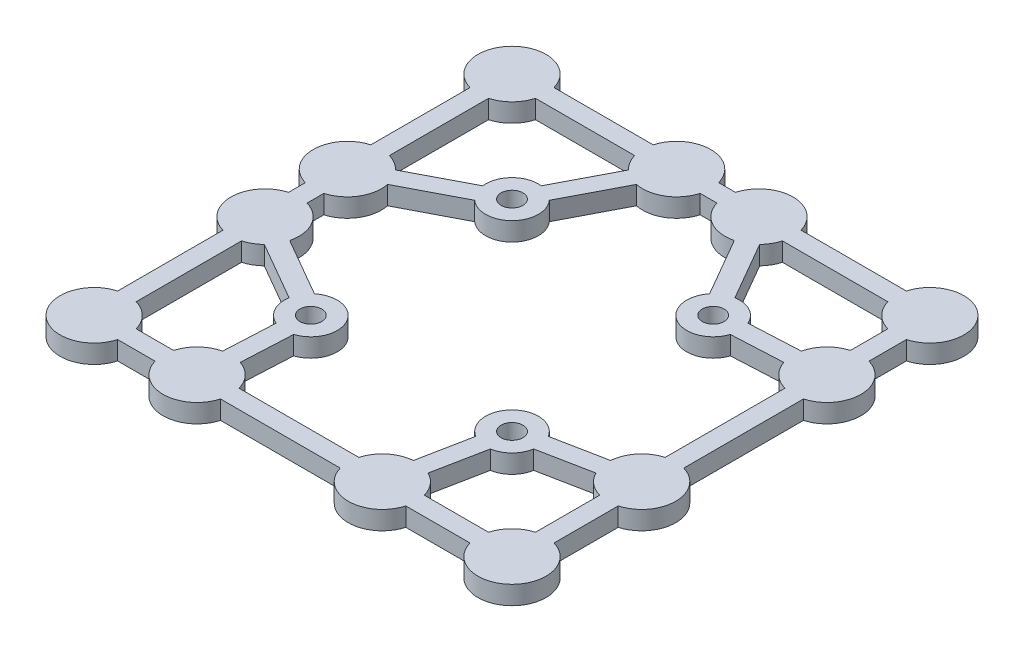
from build123d import *

# Parameters (mm, degrees)
SKETCH1_R           = 3.525
BOSS_EXTRUDE1_DEPTH = 6


with BuildPart() as part:
    # Sketch1 → Boss-Extrude1 (new body)
    with BuildSketch(Plane(origin=(0, 0, 0), x_dir=(1, 0, 0), z_dir=(0, 1, 0))):
        with BuildLine():
            Line((-56.916994756, 70.5), (-24.883005244, 70.5))
            ThreePointArc((-24.883005244, 70.5), (-14.3, 78.5), (-3.716994756, 70.5))
            Line((-3.716994756, 70.5), (1.716994756, 70.5))
            ThreePointArc((1.716994756, 70.5), (12.3, 78.5), (22.883005244, 70.5))
            Line((22.883005244, 70.5), (56.916994756, 70.5))
            ThreePointArc((56.916994756, 70.5), (75.278174593, 75.278174593), (70.5, 56.916994756))
            Line((70.5, 56.916994756), (70.5, 44.833005244))
            ThreePointArc((70.5, 44.833005244), (78.5, 34.25), (70.5, 23.666994756))
            Line((70.5, 23.666994756), (70.5, -15.016994756))
            ThreePointArc((70.5, -15.016994756), (78.5, -25.6), (70.5, -36.183005244))
            Line((70.5, -36.183005244), (70.5, -56.916994756))
            ThreePointArc((70.5, -56.916994756), (75.278174593, -75.278174593), (56.916994756, -70.5))
            Line((56.916994756, -70.5), (36.183005244, -70.5))
            ThreePointArc((36.183005244, -70.5), (25.6, -78.5), (15.016994756, -70.5))
            Line((15.016994756, -70.5), (-23.666994756, -70.5))
            ThreePointArc((-23.666994756, -70.5), (-34.25, -78.5), (-44.833005244, -70.5))
            Line((-44.833005244, -70.5), (-56.916994756, -70.5))
            ThreePointArc((-56.916994756, -70.5), (-75.278174593, -75.278174593), (-70.5, -56.916994756))
            Line((-70.5, -56.916994756), (-70.5, -22.883005244))
            ThreePointArc((-70.5, -22.883005244), (-78.5, -12.3), (-70.5, -1.716994756))
            Line((-70.5, -1.716994756), (-70.5, 3.716994756))
            ThreePointArc((-70.5, 3.716994756), (-78.5, 14.3), (-70.5, 24.883005244))
            Line((-70.5, 24.883005244), (-70.5, 56.916994756))
            ThreePointArc((-70.5, 56.916994756), (-75.278174593, 75.278174593), (-56.916994756, 70.5))
        make_face()
        with Locations(Location((-32.5, 32.5, 0), (0, 0, 270))):
            Circle(SKETCH1_R, mode=Mode.SUBTRACT)
        with Locations(Location((32.5, 32.5, 0), (0, 0, 270))):
            Circle(SKETCH1_R, mode=Mode.SUBTRACT)
        with Locations(Location((32.5, -32.5, 0), (0, 0, 270))):
            Circle(SKETCH1_R, mode=Mode.SUBTRACT)
        with Locations(Location((-32.5, -32.5, 0), (0, 0, 270))):
            Circle(SKETCH1_R, mode=Mode.SUBTRACT)
        with BuildLine():
            Line((36.183005244, -64.5), (56.916994756, -64.5))
            ThreePointArc((56.916994756, -64.5), (59.721825407, -59.721825407), (64.5, -56.916994756))
            Line((64.5, -56.916994756), (64.5, -36.183005244))
            ThreePointArc((64.5, -36.183005244), (60.514437119, -34.097170779), (57.697103802, -30.590313229))
            Line((57.697103802, -30.590313229), (40.909272567, -33.899914244))
            ThreePointArc((40.909272567, -33.899914244), (38.52808531, -38.52808531), (33.899914244, -40.909272567))
            Line((33.899914244, -40.909272567), (30.590313229, -57.697103802))
            ThreePointArc((30.590313229, -57.697103802), (34.097170779, -60.514437119), (36.183005244, -64.5))
        make_face(mode=Mode.SUBTRACT)
        with BuildLine():
            Line((-56.916994756, 64.5), (-24.883005244, 64.5))
            ThreePointArc((-24.883005244, 64.5), (-23.702757073, 61.791396017), (-21.844148835, 59.49463815))
            Line((-21.844148835, 59.49463815), (-31.480193598, 40.963782836))
            ThreePointArc((-31.480193598, 40.963782836), (-38.52808531, 38.52808531), (-40.963782836, 31.480193598))
            Line((-40.963782836, 31.480193598), (-59.49463815, 21.844148835))
            ThreePointArc((-59.49463815, 21.844148835), (-61.791396017, 23.702757073), (-64.5, 24.883005244))
            Line((-64.5, 24.883005244), (-64.5, 56.916994756))
            ThreePointArc((-64.5, 56.916994756), (-59.721825407, 59.721825407), (-56.916994756, 64.5))
        make_face(mode=Mode.SUBTRACT)
        with BuildLine():
            Line((-64.5, -56.916994756), (-64.5, -22.883005244))
            ThreePointArc((-64.5, -22.883005244), (-61.999259001, -21.825851587), (-59.833621297, -20.188386247))
            Line((-59.833621297, -20.188386247), (-40.910840036, -31.10953429))
            ThreePointArc((-40.910840036, -31.10953429), (-39.986708997, -36.577353724), (-35.894744259, -40.319931996))
            Line((-35.894744259, -40.319931996), (-36.717766955, -56.780385909))
            ThreePointArc((-36.717766955, -56.780385909), (-41.831475725, -59.529979559), (-44.833005244, -64.5))
            Line((-44.833005244, -64.5), (-56.916994756, -64.5))
            ThreePointArc((-56.916994756, -64.5), (-59.721825407, -59.721825407), (-64.5, -56.916994756))
        make_face(mode=Mode.SUBTRACT)
        with BuildLine():
            Line((-3.716994756, 64.5), (1.716994756, 64.5))
            ThreePointArc((1.716994756, 64.5), (6.799259001, 57.974148413), (14.991767169, 56.834429715))
            Line((14.991767169, 56.834429715), (25.912915211, 37.911648453))
            ThreePointArc((25.912915211, 37.911648453), (28.422646276, 25.013291003), (40.619557697, 29.902230226))
            Line((40.619557697, 29.902230226), (57.080011611, 30.725252921))
            ThreePointArc((57.080011611, 30.725252921), (59.918524275, 26.279979559), (64.5, 23.666994756))
            Line((64.5, 23.666994756), (64.5, -15.016994756))
            ThreePointArc((64.5, -15.016994756), (59.002829221, -18.614437119), (56.536583679, -24.703616953))
            Line((56.536583679, -24.703616953), (39.748752444, -28.013217968))
            ThreePointArc((39.748752444, -28.013217968), (26.47191469, -26.47191469), (28.013217968, -39.748752444))
            Line((28.013217968, -39.748752444), (24.703616953, -56.536583679))
            ThreePointArc((24.703616953, -56.536583679), (18.614437119, -59.002829221), (15.016994756, -64.5))
            Line((15.016994756, -64.5), (-23.666994756, -64.5))
            ThreePointArc((-23.666994756, -64.5), (-26.279979559, -59.918524275), (-30.725252921, -57.080011611))
            Line((-30.725252921, -57.080011611), (-29.902230226, -40.619557697))
            ThreePointArc((-29.902230226, -40.619557697), (-25.013291003, -28.422646276), (-37.911648453, -25.912915211))
            Line((-37.911648453, -25.912915211), (-56.834429715, -14.991767169))
            ThreePointArc((-56.834429715, -14.991767169), (-57.974148413, -6.799259001), (-64.5, -1.716994756))
            Line((-64.5, -1.716994756), (-64.5, 3.716994756))
            ThreePointArc((-64.5, 3.716994756), (-58.097242927, 8.591396017), (-56.72652173, 16.520848028))
            Line((-56.72652173, 16.520848028), (-38.195666417, 26.156892791))
            ThreePointArc((-38.195666417, 26.156892791), (-26.47191469, 26.47191469), (-26.156892791, 38.195666417))
            Line((-26.156892791, 38.195666417), (-16.520848028, 56.72652173))
            ThreePointArc((-16.520848028, 56.72652173), (-8.591396017, 58.097242927), (-3.716994756, 64.5))
        make_face(mode=Mode.SUBTRACT)
        with BuildLine():
            Line((22.883005244, 64.5), (56.916994756, 64.5))
            ThreePointArc((56.916994756, 64.5), (59.721825407, 59.721825407), (64.5, 56.916994756))
            Line((64.5, 56.916994756), (64.5, 44.833005244))
            ThreePointArc((64.5, 44.833005244), (59.529979559, 41.831475725), (56.780385909, 36.717766955))
            Line((56.780385909, 36.717766955), (40.319931996, 35.894744259))
            ThreePointArc((40.319931996, 35.894744259), (36.577353724, 39.986708997), (31.10953429, 40.910840036))
            Line((31.10953429, 40.910840036), (20.188386247, 59.833621297))
            ThreePointArc((20.188386247, 59.833621297), (21.825851587, 61.999259001), (22.883005244, 64.5))
        make_face(mode=Mode.SUBTRACT)
    extrude(amount=BOSS_EXTRUDE1_DEPTH)


solid = part.part
